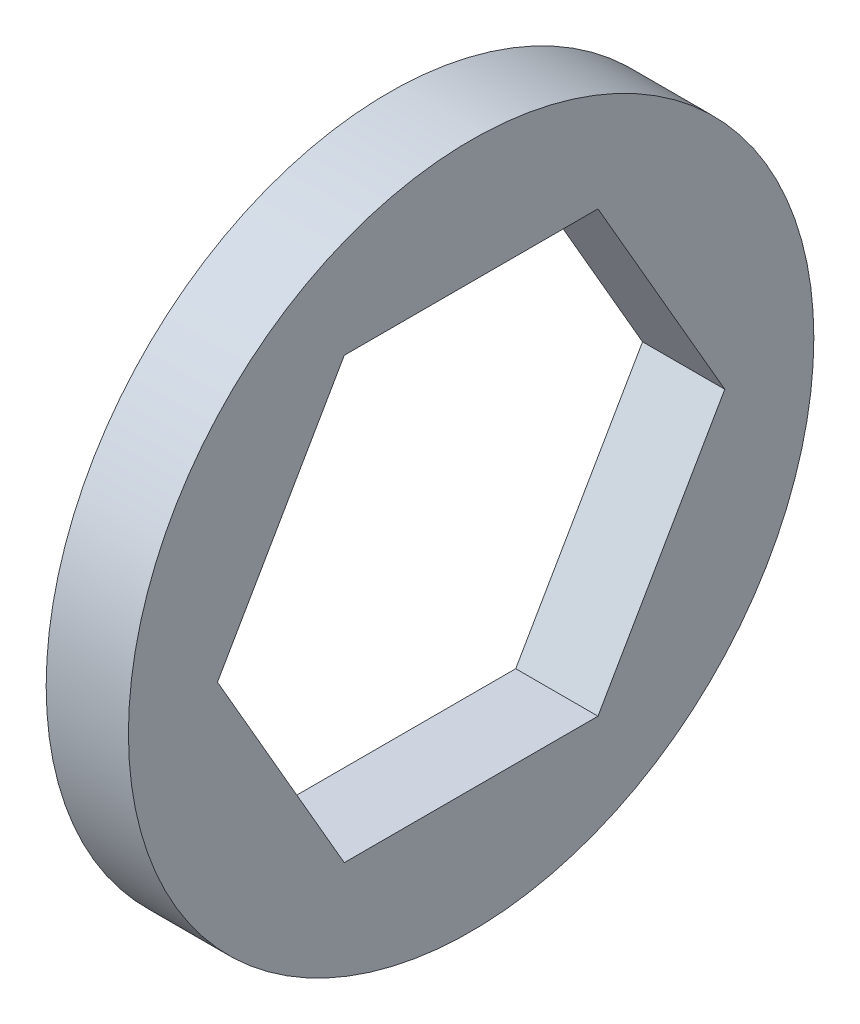
from build123d import *

# Parameters (mm, degrees)
SKETCH1_R           = 25
BOSS_EXTRUDE1_DEPTH = 6


with BuildPart() as part:
    # Sketch1 → Boss-Extrude1 (new body)
    with BuildSketch(Plane(origin=(0, 0, 0), x_dir=(0, 0, -1), z_dir=(1, 0, 0))):
        Circle(SKETCH1_R)
        Polygon((18.504076128, 0), (9.252038064, 16.025), (-9.252038064, 16.025), (-18.504076128, 0), (-9.252038064, -16.025), (9.252038064, -16.025), align=None, mode=Mode.SUBTRACT)
    extrude(amount=BOSS_EXTRUDE1_DEPTH)


solid = part.part
